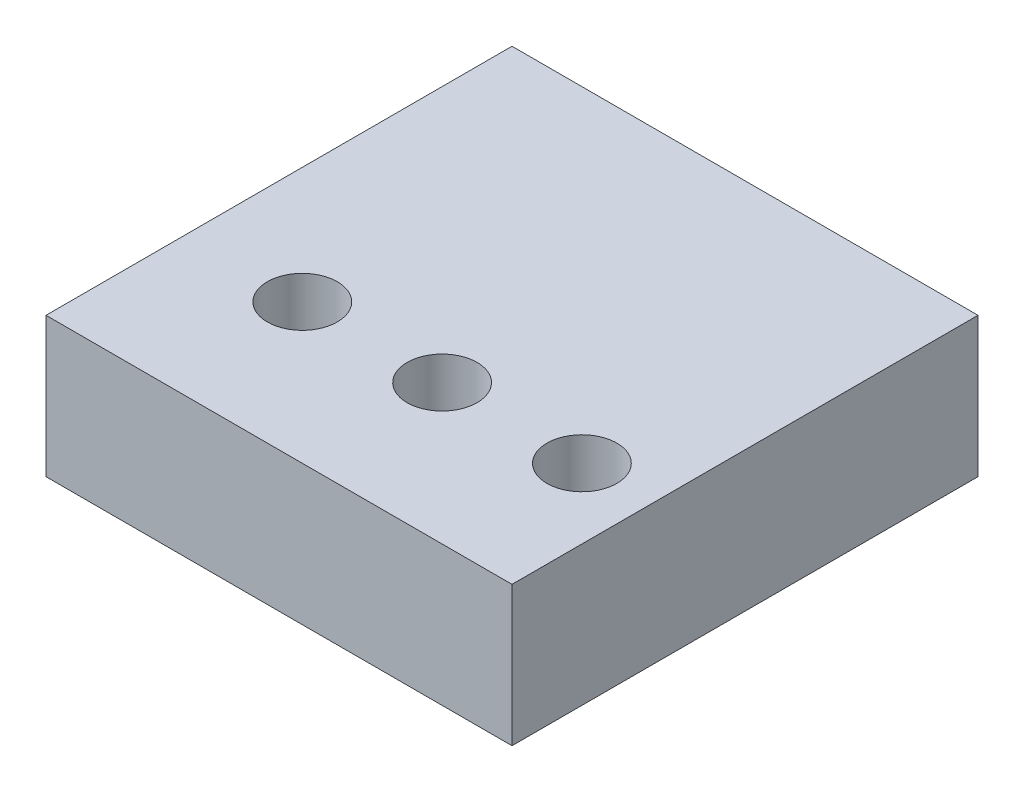
from build123d import *

# Parameters (mm, degrees)
SKETCH_1_W          = 100
SKETCH_1_H          = 100
EXTRUDE_1_DEPTH     = 30
SKETCH_2_R          = 7.5
CUT_EXTRUDE_1_DEPTH = 30


with BuildPart() as part:
    # ｽｹｯﾁ1 → 押し出し1 (new body)
    with BuildSketch(Plane(origin=(0, 0, 0), x_dir=(1, 0, 0), z_dir=(0, 1, 0))):
        with Locations((50, 50)):
            Rectangle(SKETCH_1_W, SKETCH_1_H)
    extrude(amount=EXTRUDE_1_DEPTH)

    # ｽｹｯﾁ2 → ｶｯﾄ - 押し出し1 (cut)
    with BuildSketch(Plane(origin=(0, 30, 0), x_dir=(-1, 0, 0), z_dir=(0, 1, 0))):
        with Locations(Location((-55, -30, 0), (0, 0, 90))):
            Circle(SKETCH_2_R)
        with Locations(Location((-25, -30, 0), (0, 0, 90))):
            Circle(SKETCH_2_R)
        with Locations(Location((-85, -30, 0), (0, 0, 90))):
            Circle(SKETCH_2_R)
    extrude(amount=-CUT_EXTRUDE_1_DEPTH, mode=Mode.SUBTRACT)


solid = part.part
